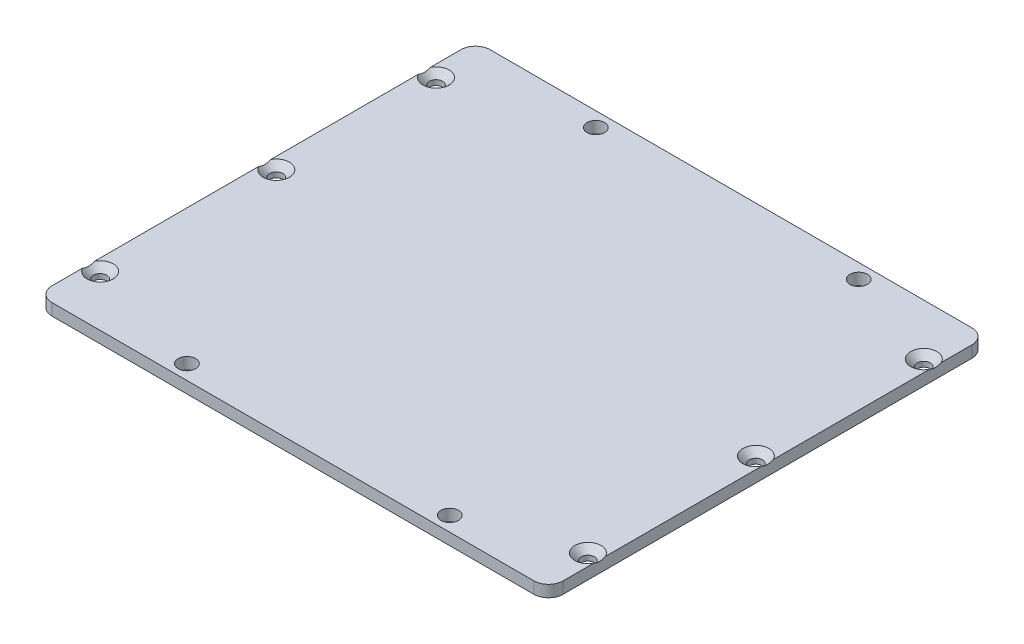
from build123d import *

# Parameters (mm, degrees)
IZIM1_W                       = 175
IZIM1_H                       = 150
Y_KSEKLIK_EKSTR_ZYON1_DEPTH   = 4
RADYUS1_R                     = 5
IZIM2_R                       = 2
IZIM2_R_2                     = 3
KES_EKSTR_ZYON1_DEPTH         = 10
M4_SFHCS_IN_HAV_A1_AT_2_COUNT = 2
M4_SFHCS_IN_HAV_A1_AT_2_PITCH = 54.690877802
M4_SFHCS_IN_HAV_A1_AT_3_COUNT = 2
M4_SFHCS_IN_HAV_A1_AT_3_PITCH = 115
M4_SFHCS_IN_HAV_A1_AT_4_COUNT = 2
M4_SFHCS_IN_HAV_A1_AT_4_PITCH = 202.765874841
M4_SFHCS_IN_HAV_A1_AT_5_COUNT = 2
M4_SFHCS_IN_HAV_A1_AT_5_PITCH = 176.621771025
M4_SFHCS_IN_HAV_A1_AT_6_COUNT = 2
M4_SFHCS_IN_HAV_A1_AT_6_PITCH = 167


with BuildPart() as part:
    # Çizim1 → Yükseklik-Ekstrüzyon1 (new body)
    with BuildSketch(Plane(origin=(0, 0, 0), x_dir=(1, 0, 0), z_dir=(0, 1, 0))):
        Rectangle(IZIM1_W, IZIM1_H)
    extrude(amount=Y_KSEKLIK_EKSTR_ZYON1_DEPTH)

    # Radyus1
    radyus1_edges = [part.edges().sort_by_distance(p)[0] for p in [
        (-87.5, 2, -75),
        (87.5, 2, -75),
        (87.5, 2, 75),
        (-87.5, 2, 75),
    ]]
    fillet(radyus1_edges, radius=RADYUS1_R)

    # Çizim2 → Kes-Ekstrüzyon1 (cut)
    with BuildSketch(Plane(origin=(0, 4, 0), x_dir=(1, 0, 0), z_dir=(0, 1, 0))):
        with Locations(Location((-83.5, -57.5, 0), (0, 0, 270))):
            Circle(IZIM2_R)
        with Locations(Location((83.5, -57.5, 0), (0, 0, 270))):
            Circle(IZIM2_R)
        with Locations(Location((83.5, 0, 0), (0, 0, 270))):
            Circle(IZIM2_R)
        with Locations(Location((83.5, 57.5, 0), (0, 0, 270))):
            Circle(IZIM2_R)
        with Locations(Location((-83.5, 57.5, 0), (0, 0, 270))):
            Circle(IZIM2_R)
        with Locations(Location((-83.5, 2.809122198, 0), (0, 0, 270))):
            Circle(IZIM2_R)
        with Locations(Location((-41.307504104, -70, 0), (0, 0, 270))):
            Circle(IZIM2_R_2)
        with Locations(Location((48.692495896, -70, 0), (0, 0, 270))):
            Circle(IZIM2_R_2)
        with Locations(Location((-41.307504104, 70, 0), (0, 0, 270))):
            Circle(IZIM2_R_2)
        with Locations(Location((48.692495896, 70, 0), (0, 0, 270))):
            Circle(IZIM2_R_2)
    extrude(amount=-KES_EKSTR_ZYON1_DEPTH, mode=Mode.SUBTRACT)

    # Çizim3 → M4 SFHCS İçin Havşa1 (revolve, cut)
    with BuildSketch(Plane(origin=(-83.5, 4, -57.5), x_dir=(0, 0, 1), z_dir=(1, 0, 0))):
        Polygon((0, 0), (0, 4), (2.25, 4), (2.25, 2.23), (4.48, 0), align=None)
    m4_sfhcs_in_hav_a1 = revolve(axis=Axis((-83.5, 10.35, -57.5), (0, -1, 0)), mode=Mode.SUBTRACT)

    # M4 SFHCS İçin Havşa1 at 2: M4 SFHCS İçin Havşa1 ×2
    with Locations(*[(0, 0, i * M4_SFHCS_IN_HAV_A1_AT_2_PITCH) for i in range(1, M4_SFHCS_IN_HAV_A1_AT_2_COUNT)]):
        add(m4_sfhcs_in_hav_a1, mode=Mode.SUBTRACT)

    # M4 SFHCS İçin Havşa1 at 3: M4 SFHCS İçin Havşa1 ×2
    with Locations(*[(0, 0, i * M4_SFHCS_IN_HAV_A1_AT_3_PITCH) for i in range(1, M4_SFHCS_IN_HAV_A1_AT_3_COUNT)]):
        add(m4_sfhcs_in_hav_a1, mode=Mode.SUBTRACT)

    # M4 SFHCS İçin Havşa1 at 4: M4 SFHCS İçin Havşa1 ×2
    with Locations(*[Vector(0.8236099892599149, 0, 0.5671565794304804) * (i * M4_SFHCS_IN_HAV_A1_AT_4_PITCH) for i in range(1, M4_SFHCS_IN_HAV_A1_AT_4_COUNT)]):
        add(m4_sfhcs_in_hav_a1, mode=Mode.SUBTRACT)

    # M4 SFHCS İçin Havşa1 at 5: M4 SFHCS İçin Havşa1 ×2
    with Locations(*[Vector(0.9455233011811556, 0, 0.3255544300474038) * (i * M4_SFHCS_IN_HAV_A1_AT_5_PITCH) for i in range(1, M4_SFHCS_IN_HAV_A1_AT_5_COUNT)]):
        add(m4_sfhcs_in_hav_a1, mode=Mode.SUBTRACT)

    # M4 SFHCS İçin Havşa1 at 6: M4 SFHCS İçin Havşa1 ×2
    with Locations(*[(i * M4_SFHCS_IN_HAV_A1_AT_6_PITCH, 0, 0) for i in range(1, M4_SFHCS_IN_HAV_A1_AT_6_COUNT)]):
        add(m4_sfhcs_in_hav_a1, mode=Mode.SUBTRACT)


solid = part.part
